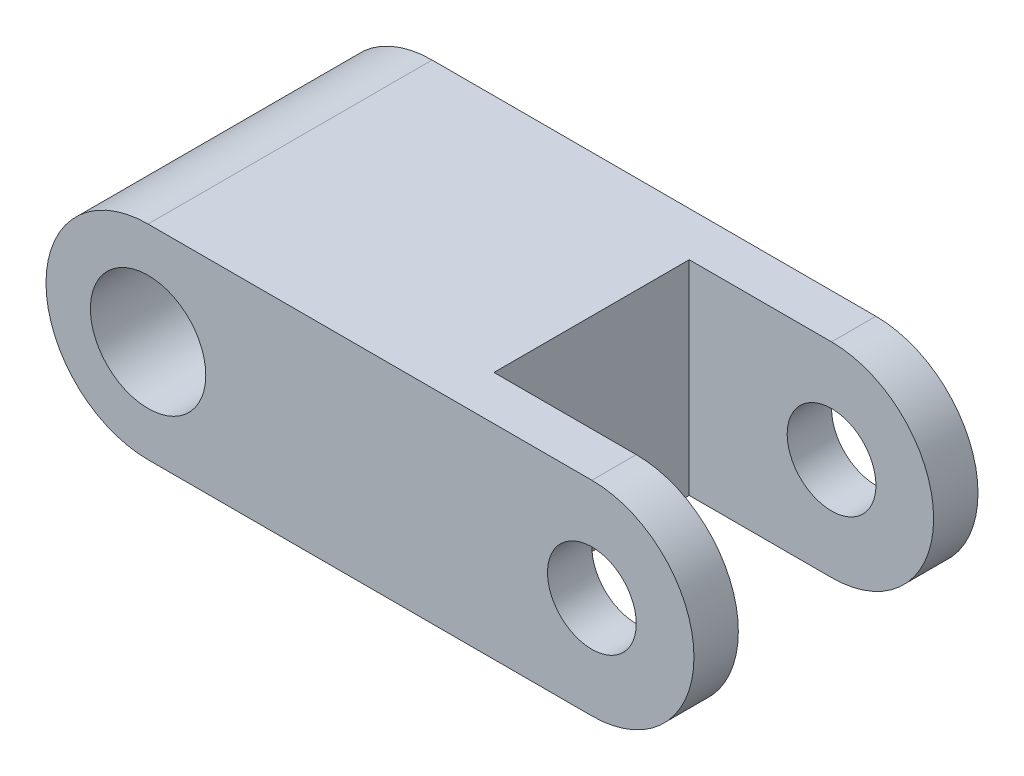
from build123d import *

# Parameters (mm, degrees)
SKETCH1_R           = 6.5
SKETCH1_R_2         = 5
BOSS_EXTRUDE1_DEPTH = 32
CUT_EXTRUDE1_REACH  = 75.043
SKETCH2_W           = 27.533543241
SKETCH2_H           = 22


with BuildPart() as part:
    # Sketch1 → Boss-Extrude1 (new body)
    with BuildSketch(Plane.XY):
        with BuildLine():
            Line((0, 11.5), (50, 11.5))
            ThreePointArc((50, 11.5), (61.5, 0), (50, -11.5))
            Line((50, -11.5), (0, -11.5))
            ThreePointArc((0, -11.5), (-11.5, 0), (0, 11.5))
        make_face()
        Circle(SKETCH1_R, mode=Mode.SUBTRACT)
        with Locations((50, 0)):
            Circle(SKETCH1_R_2, mode=Mode.SUBTRACT)
    extrude(amount=BOSS_EXTRUDE1_DEPTH)

    # Sketch2 → Cut-Extrude1 (cut, up to next)
    with BuildSketch(Plane(origin=(0, 11.5, 0), x_dir=(1, 0, 0), z_dir=(0, 1, 0)), mode=Mode.PRIVATE) as cut_extrude1_sk1:
        with Locations((47.73322838, -16)):
            Rectangle(SKETCH2_W, SKETCH2_H)
    cut_extrude1_tool1 = extrude(cut_extrude1_sk1.sketch, amount=-CUT_EXTRUDE1_REACH, mode=Mode.PRIVATE) & part.part
    add(cut_extrude1_tool1.solids().sort_by_distance((47.733228, 11.5, 16))[0], mode=Mode.SUBTRACT)


solid = part.part
